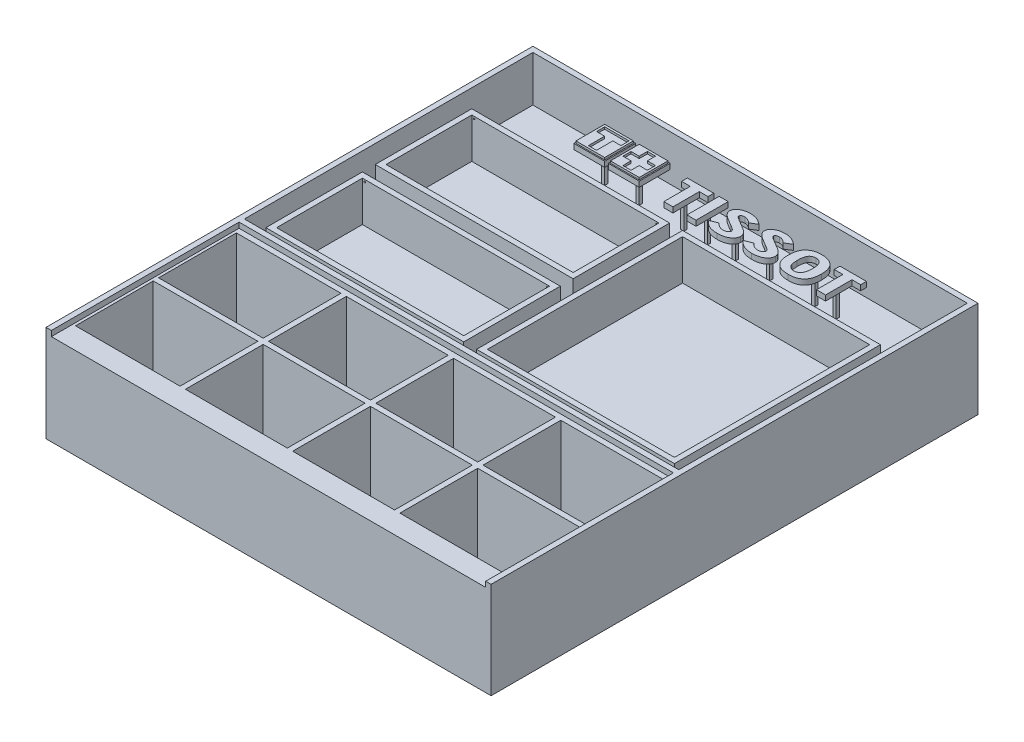
from build123d import *

# Parameters (mm, degrees)
SKETCH1_W                                     = 2025
SKETCH1_H                                     = 2145
BOSS_EXTRUDE1_DEPTH                           = 25
BOSS_EXTRUDE2_DEPTH                           = 450
BOSS_EXTRUDE3_DEPTH                           = 425
BOSS_EXTRUDE4_START                           = 25
BOSS_EXTRUDE4_DEPTH                           = 400
SKETCH12_W                                    = 25
SKETCH12_H                                    = 750
SKETCH12_W_2                                  = 2000
SKETCH12_H_2                                  = 25
EXTRUDE_THIN2_DEPTH                           = 400
CBORE_FOR_M4_PAN_HEAD_MACHINE_SCREW1_AT_COUNT = 2
CBORE_FOR_M4_PAN_HEAD_MACHINE_SCREW1_AT_PITCH = 27
SKETCH2_W                                     = 1345
SKETCH2_H                                     = 25
SHELVES_BACKGROUND_DEPTH                      = 2050
STONE_ON_COUNTER_START                        = -25
STONE_ON_COUNTER_DEPTH                        = 2025
SKETCH3_W                                     = 922.5
SKETCH3_H                                     = 450
SKETCH3_W_2                                   = 872.5
SKETCH3_H_2                                   = 400
SKETCH3_H_3                                   = 960
SKETCH3_H_4                                   = 910
PROTRUDED_SHELVES_DEPTH                       = 187.5
BOTTOM_LEFT_HINGE_HOLE_START                  = -10
SKETCH9_R                                     = 3.5
BOTTOM_LEFT_HINGE_HOLE_DEPTH                  = 420
TOP_LEFT_HINGE_HOLE_START                     = -10
SKETCH11_R                                    = 3.5
TOP_LEFT_HINGE_HOLE_DEPTH                     = 420
SKETCH5_W                                     = 15
SKETCH5_H                                     = 15
LOGO_DEPTH                                    = 137.5
LOGO_EXTRUSION_START                          = 137.5
SKETCH5_3_W                                   = 144
SKETCH5_3_H                                   = 144
LOGO_EXTRUSION_DEPTH                          = 25
LOGO_EXTRUSION_2_DEPTH                        = 25
LOGO_SUPPORT_START                            = 162.5
SKETCH5_5_W                                   = 134
SKETCH5_5_H                                   = 134
LOGO_SUPPORT_DEPTH                            = 10
NAME_DEPTH                                    = 25
SKETCH7_W                                     = 42.307692308
SKETCH7_H                                     = 150
NAME_2_DEPTH                                  = 25
NAME_3_DEPTH                                  = 25
NAME_4_DEPTH                                  = 25
NAME_5_DEPTH                                  = 25
NAME_6_DEPTH                                  = 25
SKETCH8_W                                     = 15
SKETCH8_H                                     = 15
NAME_SUPPORT_DEPTH                            = 137.5
LPATTERN3_COUNT                               = 4
LPATTERN3_PITCH                               = 500
LPATTERN3_COUNT_DIR2                          = 2
LPATTERN3_PITCH_DIR2                          = 387.5


with BuildPart() as part:
    # Sketch1 → Boss-Extrude1 (new body)
    with BuildSketch(Plane(origin=(0, 0, 0), x_dir=(1, 0, 0), z_dir=(0, 1, 0))):
        with Locations((0, 37.5)):
            Rectangle(SKETCH1_W, SKETCH1_H)
    extrude(amount=BOSS_EXTRUDE1_DEPTH)

    # Sketch1<3> → Boss-Extrude2 (add)
    with BuildSketch(Plane(origin=(0, 0, 0), x_dir=(1, 0, 0), z_dir=(0, 1, 0))):
        Polygon((-1012.5, -1135), (-1012.5, -1035), (-1012.5, -285), (-1012.5, -260), (-1012.5, 1110), (1012.5, 1110), (1012.5, -260), (1012.5, -285), (1012.5, -1035), (1012.5, -1135), (1037.5, -1135), (1037.5, 1135), (-1037.5, 1135), (-1037.5, -1135), align=None)
    extrude(amount=BOSS_EXTRUDE2_DEPTH)

    # Sketch1<4> → Boss-Extrude3 (add)
    with BuildSketch(Plane(origin=(0, 0, 0), x_dir=(1, 0, 0), z_dir=(0, 1, 0))):
        Polygon((-1000, -1035), (-1012.5, -1035), (-1012.5, -1135), (1012.5, -1135), (1012.5, -1035), (1000, -1035), align=None)
    extrude(amount=BOSS_EXTRUDE3_DEPTH)

    # Sketch1<5> → Boss-Extrude4 (add)
    with BuildSketch(Plane(origin=(0, 0, 0), x_dir=(1, 0, 0), z_dir=(0, 1, 0)).offset(BOSS_EXTRUDE4_START)):
        Polygon((-1012.5, -1035), (-1000, -1035), (-1000, -285), (1000, -285), (1000, -1035), (1012.5, -1035), (1012.5, -260), (-1012.5, -260), align=None)
    extrude(amount=BOSS_EXTRUDE4_DEPTH)

    # Sketch12 → Extrude-Thin2 (add)
    with BuildSketch(Plane(origin=(0, 25, 0), x_dir=(1, 0, 0), z_dir=(0, 1, 0))):
        with Locations((0, -660)):
            Rectangle(SKETCH12_W, SKETCH12_H)
        with Locations((-500, -660)):
            Rectangle(SKETCH12_W, SKETCH12_H)
        with Locations((500, -660)):
            Rectangle(SKETCH12_W, SKETCH12_H)
        with Locations((0, -660)):
            Rectangle(SKETCH12_W_2, SKETCH12_H_2)
    extrude(amount=EXTRUDE_THIN2_DEPTH)

    # Sketch17 → CBORE for M4 Pan Head Machine Screw1 (revolve, cut)
    with BuildSketch(Plane(origin=(-512.5, 395, 840.25), x_dir=(0, 0, 1), z_dir=(0, 1, 0))):
        Polygon((0, 0), (0, 21.351936393), (2.25, 20), (2.25, 3.1), (4.5, 3.1), (4.5, 0), align=None)
    cbore_for_m4_pan_head_machine_screw1 = revolve(axis=Axis((-518.85, 395, 840.25), (1, 0, 0)), mode=Mode.SUBTRACT)

    # CBORE for M4 Pan Head Machine Screw1 at: CBORE for M4 Pan Head Machine Screw1 ×2
    with Locations(*[(0, 0, i * CBORE_FOR_M4_PAN_HEAD_MACHINE_SCREW1_AT_PITCH) for i in range(1, CBORE_FOR_M4_PAN_HEAD_MACHINE_SCREW1_AT_COUNT)]):
        add(cbore_for_m4_pan_head_machine_screw1, mode=Mode.SUBTRACT)

    # Sketch2 → shelves_background (add)
    with BuildSketch(Plane.ZY.offset(1037.5)):
        with Locations((-437.5, 225)):
            Rectangle(SKETCH2_W, SKETCH2_H)
    extrude(amount=-SHELVES_BACKGROUND_DEPTH)

    # Sketch2<3> → stone_on_counter (add)
    with BuildSketch(Plane.ZY.offset(1037.5).offset(STONE_ON_COUNTER_START)):
        Polygon((235, 450), (235, 237.5), (235, 212.5), (235, 25), (260, 25), (260, 425), (260, 450), align=None)
    extrude(amount=-STONE_ON_COUNTER_DEPTH)

    # Sketch3 → protruded_shelves (add)
    # profile 1 of 3: a face of its own
    with BuildSketch(Plane(origin=(0, 237.5, 0), x_dir=(1, 0, 0), z_dir=(0, 1, 0))):
        with Locations((-491.25, 540)):
            Rectangle(SKETCH3_W, SKETCH3_H)
        with Locations((-491.25, 540)):
            Rectangle(SKETCH3_W_2, SKETCH3_H_2, mode=Mode.SUBTRACT)
    # profile 2 of 3: a face of its own
    with BuildSketch(Plane(origin=(0, 237.5, 0), x_dir=(1, 0, 0), z_dir=(0, 1, 0))):
        with Locations((-491.25, 30)):
            Rectangle(SKETCH3_W, SKETCH3_H)
        with Locations((-491.25, 30)):
            Rectangle(SKETCH3_W_2, SKETCH3_H_2, mode=Mode.SUBTRACT)
    # profile 3 of 3: a face of its own
    with BuildSketch(Plane(origin=(0, 237.5, 0), x_dir=(1, 0, 0), z_dir=(0, 1, 0))):
        with Locations((491.25, 285)):
            Rectangle(SKETCH3_W, SKETCH3_H_3)
        with Locations((491.25, 285)):
            Rectangle(SKETCH3_W_2, SKETCH3_H_4, mode=Mode.SUBTRACT)
    extrude(amount=PROTRUDED_SHELVES_DEPTH)

    # Sketch9 → bottom_left_hinge_hole (cut)
    with BuildSketch(Plane(origin=(0, 0, 170), x_dir=(-1, 0, 0), z_dir=(0, 0, -1)).offset(BOTTOM_LEFT_HINGE_HOLE_START)):
        with Locations(Location((916.5, 415, 0), (0, 0, 180))):
            Circle(SKETCH9_R)
        with Locations(Location((66, 415, 0), (0, 0, 180))):
            Circle(SKETCH9_R)
    extrude(amount=BOTTOM_LEFT_HINGE_HOLE_DEPTH, mode=Mode.SUBTRACT)

    # Sketch11 → top_left_hinge_hole (cut)
    with BuildSketch(Plane(origin=(0, 0, -340), x_dir=(-1, 0, 0), z_dir=(0, 0, -1)).offset(TOP_LEFT_HINGE_HOLE_START)):
        with Locations(Location((916.5, 415, 0), (0, 0, 180))):
            Circle(SKETCH11_R)
        with Locations(Location((66, 415, 0), (0, 0, 180))):
            Circle(SKETCH11_R)
    extrude(amount=TOP_LEFT_HINGE_HOLE_DEPTH, mode=Mode.SUBTRACT)

    # Sketch5 → logo (add)
    with BuildSketch(Plane(origin=(0, 237.5, 0), x_dir=(1, 0, 0), z_dir=(0, 1, 0))):
        with Locations((-528, 960)):
            Rectangle(SKETCH5_W, SKETCH5_H)
        with Locations((-367, 960)):
            Rectangle(SKETCH5_W, SKETCH5_H)
    extrude(amount=LOGO_DEPTH)



with BuildPart() as body_2:
    # Sketch5<3> → logo_extrusion (new body)
    with BuildSketch(Plane(origin=(0, 237.5, 0), x_dir=(1, 0, 0), z_dir=(0, 1, 0)).offset(LOGO_EXTRUSION_START)):
        with Locations((-528, 960)):
            Rectangle(SKETCH5_3_W, SKETCH5_3_H)
    extrude(amount=LOGO_EXTRUSION_DEPTH)


with BuildPart() as body_3:
    # Sketch5<3> → logo_extrusion 2 (new body)
    with BuildSketch(Plane(origin=(0, 237.5, 0), x_dir=(1, 0, 0), z_dir=(0, 1, 0)).offset(LOGO_EXTRUSION_START)):
        with Locations((-367, 960)):
            Rectangle(SKETCH5_3_W, SKETCH5_3_H)
    extrude(amount=LOGO_EXTRUSION_2_DEPTH)


with BuildPart() as part_1:
    add(part.part)

    add(body_2.part)  # logo_support merges body 2

    add(body_3.part)  # logo_support merges body 3
    # Sketch5<5> → logo_support (add)
    # profile 1 of 2: a face of its own
    with BuildSketch(Plane(origin=(0, 237.5, 0), x_dir=(1, 0, 0), z_dir=(0, 1, 0)).offset(LOGO_SUPPORT_START)):
        with Locations((-528, 960)):
            Rectangle(SKETCH5_5_W, SKETCH5_5_H)
        Polygon((-547, 979), (-585, 979), (-585, 1017), (-471, 1017), (-471, 979), (-509, 979), (-509, 903), (-547, 903), align=None, mode=Mode.SUBTRACT)
    # profile 2 of 2: a face of its own
    with BuildSketch(Plane(origin=(0, 237.5, 0), x_dir=(1, 0, 0), z_dir=(0, 1, 0)).offset(LOGO_SUPPORT_START)):
        with Locations((-367, 960)):
            Rectangle(SKETCH5_5_W, SKETCH5_5_H)
        Polygon((-348, 903), (-386, 903), (-386, 941), (-424, 941), (-424, 979), (-386, 979), (-386, 1017), (-348, 1017), (-348, 979), (-310, 979), (-310, 941), (-348, 941), align=None, mode=Mode.SUBTRACT)
    extrude(amount=LOGO_SUPPORT_DEPTH)



with BuildPart() as body_2_2:
    # Sketch7 → name (new body)
    with BuildSketch(Plane(origin=(0, 375, 0), x_dir=(-1, 0, 0), z_dir=(0, -1, 0))):
        Polygon((220.384615385, 1038), (97.307692308, 1038), (97.307692308, 1011.076923077), (137.692307692, 1011.076923077), (137.692307692, 888), (180, 888), (180, 1011.076923077), (220.384615385, 1011.076923077), align=None)
    extrude(amount=NAME_DEPTH)


with BuildPart() as body_3_2:
    # Sketch7 → name 2 (new body)
    with BuildSketch(Plane(origin=(0, 375, 0), x_dir=(-1, 0, 0), z_dir=(0, -1, 0))):
        with Locations((51.153846154, 963)):
            Rectangle(SKETCH7_W, SKETCH7_H)
    extrude(amount=NAME_2_DEPTH)


with BuildPart() as body_4:
    # Sketch7 → name 3 (new body)
    with BuildSketch(Plane(origin=(0, 375, 0), x_dir=(-1, 0, 0), z_dir=(0, -1, 0))):
        with BuildLine():
            Line((-133.461538462, 1017.957932692), (-103.293269231, 999.538461538))
            add(Edge.make_bspline(
                [(-103.293269231, 999.538461538), (-101.978335007, 1000.760061751), (-99.424072217, 1003.133023005), (-95.408678914, 1006.273865062), (-91.379562967, 1008.929371206), (-87.334461858, 1011.118986276), (-83.258708897, 1012.819912508), (-79.158283255, 1014.022906981), (-75.036270385, 1014.784232357), (-72.276818472, 1014.876892776), (-70.901442308, 1014.923076923)],
                knots=[0, 0, 0, 0, 1.171147426, 2.2749566, 3.323050126, 4.317573864, 5.273103732, 6.19990856, 7.102791809, 8, 8, 8, 8], degree=3))
            add(Edge.make_bspline(
                [(-70.901442308, 1014.923076923), (-69.627142137, 1014.893902899), (-67.18460837, 1014.837983154), (-63.697076713, 1014.265651715), (-60.57058469, 1013.307727204), (-57.852858452, 1012.010234562), (-55.648615622, 1010.472023865), (-53.962458732, 1008.839406217), (-52.909455074, 1007.015486427), (-52.762744888, 1005.719549522), (-52.692307692, 1005.097355769)],
                knots=[0, 0, 0, 0, 1.360082956, 2.606959194, 3.76074026, 4.842022925, 5.809530102, 6.618933995, 7.336934817, 8, 8, 8, 8], degree=3))
            add(Edge.make_bspline(
                [(-52.692307692, 1005.097355769), (-52.742544589, 1004.470345068), (-52.845170472, 1003.18946327), (-53.586108064, 1001.31626791), (-54.78694529, 999.517922907), (-55.855889592, 998.468155771), (-56.418269231, 997.915865385)],
                knots=[0, 0, 0, 0, 0.902897558, 1.844474178, 2.86596165, 4, 4, 4, 4], degree=3))
            add(Edge.make_bspline(
                [(-56.418269231, 997.915865385), (-56.943715447, 997.47811864), (-58.169930505, 996.456564706), (-60.434430616, 994.895356256), (-63.271777317, 992.921780945), (-66.804599465, 990.697529442), (-70.938509883, 988.10282689), (-75.739696796, 985.236332039), (-81.133551191, 981.969426187), (-84.979923225, 979.739971512), (-87.007211538, 978.564903846)],
                knots=[0, 0, 0, 0, 0.452903437, 1.056924567, 1.820784647, 2.743020471, 3.822058125, 5.054585401, 6.447574873, 8, 8, 8, 8], degree=3))
            add(Edge.make_bspline(
                [(-87.007211538, 978.564903846), (-88.900577986, 977.473747287), (-92.48927624, 975.405562523), (-97.58198804, 972.458591894), (-102.075361931, 969.817799609), (-105.997742433, 967.504145195), (-109.318637311, 965.493482938), (-112.066248461, 963.82146044), (-114.202221106, 962.436421817), (-115.423669297, 961.609250298), (-115.943509615, 961.257211538)],
                knots=[0, 0, 0, 0, 1.555194938, 2.947725923, 4.187355268, 5.264355205, 6.188534194, 6.950171546, 7.553199914, 8, 8, 8, 8], degree=3))
            add(Edge.make_bspline(
                [(-115.943509615, 961.257211538), (-116.970188419, 960.532974035), (-118.966043624, 959.125062246), (-121.791379179, 956.958688433), (-124.391260947, 954.818622134), (-126.751343535, 952.706900673), (-128.874927603, 950.600421903), (-130.812459549, 948.560131432), (-132.445808963, 946.46813054), (-134.383634777, 943.815530644), (-136.292980634, 940.364563701), (-138.031539861, 936.047918761), (-139.039399373, 931.50575337), (-139.166731639, 928.409382016), (-139.230769231, 926.852163462)],
                knots=[0, 0, 0, 0, 1.042789868, 2.027174983, 2.954322519, 3.837370047, 4.654520587, 5.436930517, 6.170511782, 6.855718857, 8.162256492, 9.431278027, 10.708145419, 12, 12, 12, 12], degree=3))
            add(Edge.make_bspline(
                [(-139.230769231, 926.852163462), (-139.172601916, 925.335505003), (-139.057973764, 922.346682864), (-138.157577384, 917.963837635), (-136.681641322, 913.79749529), (-134.604104519, 909.833627992), (-131.921329008, 906.098100001), (-128.696295932, 902.524627489), (-124.823607169, 899.230521995), (-120.462289852, 896.11310612), (-115.609729018, 893.324757764), (-110.386000889, 890.834252967), (-104.788018582, 888.77748491), (-98.838103899, 887.097251491), (-92.542060925, 885.781438374), (-85.899343539, 884.826494652), (-78.894706511, 884.243784247), (-74.10772685, 884.184335459), (-71.652644231, 884.153846154)],
                knots=[0, 0, 0, 0, 0.821708066, 1.619309373, 2.414467225, 3.211088349, 4.036716022, 4.901636613, 5.81393745, 6.787265425, 7.804263472, 8.843812771, 9.921025111, 11.03309076, 12.192812202, 13.405330324, 14.66928024, 16, 16, 16, 16], degree=3))
            add(Edge.make_bspline(
                [(-71.652644231, 884.153846154), (-69.718957939, 884.175974649), (-65.91824566, 884.219468801), (-60.313545979, 884.59081592), (-54.907745543, 885.181768078), (-49.683556961, 886.029037502), (-44.645707281, 887.099615366), (-39.791088133, 888.426969649), (-35.132327514, 889.9825749), (-30.655057245, 891.795974569), (-26.354446777, 893.865085607), (-22.222835061, 896.221923291), (-18.249896261, 898.843340877), (-14.414503411, 901.730989786), (-10.765580703, 904.929815615), (-7.22487719, 908.352354055), (-3.886856235, 912.090864064), (-1.815925752, 914.750640774), (-0.769230769, 916.094951923)],
                knots=[0, 0, 0, 0, 1.146972808, 2.254405821, 3.330473237, 4.371744011, 5.392591196, 6.384267033, 7.355657673, 8.304527657, 9.247912691, 10.184594247, 11.12391032, 12.069817902, 13.030078581, 14.000669363, 14.989493194, 16, 16, 16, 16], degree=3))
            Line((-0.769230769, 916.094951923), (-35.594951923, 930.307692308))
            add(Edge.make_bspline(
                [(-35.594951923, 930.307692308), (-36.899216915, 928.779403179), (-39.436942959, 925.805790343), (-43.611308885, 921.886771182), (-47.919122366, 918.549178084), (-52.390349236, 915.818856627), (-57.010399021, 913.698860568), (-61.780101513, 912.179176443), (-66.708309504, 911.246673289), (-70.056077826, 911.133794799), (-71.742788462, 911.076923077)],
                knots=[0, 0, 0, 0, 1.136826031, 2.21193779, 3.235016942, 4.217284923, 5.171404207, 6.105770855, 7.045627971, 8, 8, 8, 8], degree=3))
            add(Edge.make_bspline(
                [(-71.742788462, 911.076923077), (-73.449196368, 911.124584979), (-76.752420246, 911.216847756), (-81.476226667, 912.042092241), (-85.804578104, 913.344637934), (-89.020744157, 914.95971522), (-91.338206281, 916.396923652), (-92.816104047, 917.538558349), (-94.066191303, 918.733067577), (-95.130562849, 919.937423235), (-95.91531781, 921.228887269), (-96.511994827, 922.53323533), (-96.844759579, 923.901147716), (-96.896999635, 924.827330045), (-96.923076923, 925.289663462)],
                knots=[0, 0, 0, 0, 1.947922335, 3.77074177, 5.460842034, 7.093251747, 7.864655766, 8.57417329, 9.221652186, 9.83847831, 10.403688349, 10.941600173, 11.471666007, 12, 12, 12, 12], degree=3))
            add(Edge.make_bspline(
                [(-96.923076923, 925.289663462), (-96.86053399, 926.151796029), (-96.730912897, 927.938577681), (-95.559171106, 930.536060352), (-93.81112172, 933.129857611), (-91.778852642, 935.218547183), (-89.702867764, 936.956835347), (-87.705901965, 938.502032275), (-85.279977501, 940.191303363), (-82.44037485, 942.058293551), (-79.19210446, 944.097977783), (-75.536869439, 946.313513711), (-71.460490498, 948.698755122), (-68.590254984, 950.314101313), (-67.085336538, 951.161057692)],
                knots=[0, 0, 0, 0, 0.755635226, 1.56606444, 2.468347946, 3.503504105, 4.116475286, 4.851831446, 5.725046546, 6.717811324, 7.842987722, 9.100973178, 10.47998573, 12, 12, 12, 12], degree=3))
            add(Edge.make_bspline(
                [(-67.085336538, 951.161057692), (-64.225585395, 952.774599065), (-58.753640537, 955.862003868), (-50.985971796, 960.433460458), (-44.008268519, 964.723278433), (-37.821886528, 968.734748559), (-32.430774017, 972.462255344), (-27.809882439, 975.874873893), (-23.98663424, 979.010906667), (-20.875222032, 981.918861795), (-18.407878826, 984.745874254), (-16.227851087, 987.431140908), (-14.475278597, 990.186619005), (-12.964690149, 992.897483144), (-11.82393181, 995.632047897), (-11.012395713, 998.362192778), (-10.457116434, 1001.078457622), (-10.408653267, 1002.901201689), (-10.384615385, 1003.805288462)],
                knots=[0, 0, 0, 0, 1.958244853, 3.746972136, 5.374921427, 6.842884382, 8.143630164, 9.283370471, 10.267704041, 11.09162912, 11.81936134, 12.504123255, 13.151960596, 13.764086445, 14.353160906, 14.914442949, 15.461560299, 16, 16, 16, 16], degree=3))
            add(Edge.make_bspline(
                [(-10.384615385, 1003.805288462), (-10.434979021, 1005.091827528), (-10.534769221, 1007.640968143), (-11.3874721, 1011.386395732), (-12.744975074, 1014.989725802), (-14.66447605, 1018.446780534), (-17.140489351, 1021.730506674), (-20.102556507, 1024.915161004), (-23.650965423, 1027.909702496), (-27.681650458, 1030.730428622), (-32.100932616, 1033.32633787), (-36.821035506, 1035.614341103), (-41.802356872, 1037.530095134), (-47.018822575, 1039.13665341), (-52.495719675, 1040.358542698), (-58.228159231, 1041.227505987), (-64.21141164, 1041.738647148), (-68.286274049, 1041.809888525), (-70.360576923, 1041.846153846)],
                knots=[0, 0, 0, 0, 0.789719771, 1.56474591, 2.347746179, 3.14936716, 3.9851552, 4.869112387, 5.816364336, 6.832321499, 7.888906194, 8.962419512, 10.051625332, 11.165197109, 12.313385, 13.496280738, 14.725485295, 16, 16, 16, 16], degree=3))
            add(Edge.make_bspline(
                [(-70.360576923, 1041.846153846), (-73.05781026, 1041.781950666), (-78.399400716, 1041.654802936), (-86.29912802, 1040.660397262), (-94.002220611, 1039.075641151), (-100.276384685, 1037.188450911), (-105.25743659, 1035.306336983), (-109.070809738, 1033.624466102), (-112.945585368, 1031.649655095), (-116.932167489, 1029.464153304), (-120.964802091, 1026.95957393), (-125.092631633, 1024.227031077), (-129.27641431, 1021.211926405), (-132.045996955, 1019.058536401), (-133.461538462, 1017.957932692)],
                knots=[0, 0, 0, 0, 1.408596709, 2.789579468, 4.152263913, 5.512857549, 6.20667109, 6.932870834, 7.68864351, 8.477850492, 9.306993667, 10.167502276, 11.063405241, 12, 12, 12, 12], degree=3))
        make_face()
    extrude(amount=NAME_3_DEPTH)


with BuildPart() as body_5:
    # Sketch7 → name 4 (new body)
    with BuildSketch(Plane(origin=(0, 375, 0), x_dir=(-1, 0, 0), z_dir=(0, -1, 0))):
        with BuildLine():
            Line((-295, 1017.957932692), (-264.831730769, 999.538461538))
            add(Edge.make_bspline(
                [(-264.831730769, 999.538461538), (-263.516796545, 1000.760061751), (-260.962533755, 1003.133023005), (-256.947140452, 1006.273865062), (-252.918024506, 1008.929371206), (-248.872923396, 1011.118986276), (-244.797170435, 1012.819912508), (-240.696744793, 1014.022906981), (-236.574731924, 1014.784232357), (-233.81528001, 1014.876892776), (-232.439903846, 1014.923076923)],
                knots=[0, 0, 0, 0, 1.171147426, 2.2749566, 3.323050126, 4.317573864, 5.273103732, 6.19990856, 7.102791809, 8, 8, 8, 8], degree=3))
            add(Edge.make_bspline(
                [(-232.439903846, 1014.923076923), (-231.165603676, 1014.893902899), (-228.723069908, 1014.837983154), (-225.235538251, 1014.265651715), (-222.109046229, 1013.307727204), (-219.391319991, 1012.010234562), (-217.187077161, 1010.472023865), (-215.50092027, 1008.839406217), (-214.447916613, 1007.015486427), (-214.301206426, 1005.719549522), (-214.230769231, 1005.097355769)],
                knots=[0, 0, 0, 0, 1.360082956, 2.606959194, 3.76074026, 4.842022925, 5.809530102, 6.618933995, 7.336934817, 8, 8, 8, 8], degree=3))
            add(Edge.make_bspline(
                [(-214.230769231, 1005.097355769), (-214.281006128, 1004.470345068), (-214.38363201, 1003.18946327), (-215.124569602, 1001.31626791), (-216.325406829, 999.517922907), (-217.394351131, 998.468155771), (-217.956730769, 997.915865385)],
                knots=[0, 0, 0, 0, 0.902897558, 1.844474178, 2.86596165, 4, 4, 4, 4], degree=3))
            add(Edge.make_bspline(
                [(-217.956730769, 997.915865385), (-218.482176986, 997.47811864), (-219.708392043, 996.456564706), (-221.972892154, 994.895356256), (-224.810238856, 992.921780945), (-228.343061004, 990.697529442), (-232.476971422, 988.10282689), (-237.278158334, 985.236332039), (-242.672012729, 981.969426187), (-246.518384764, 979.739971512), (-248.545673077, 978.564903846)],
                knots=[0, 0, 0, 0, 0.452903437, 1.056924567, 1.820784647, 2.743020471, 3.822058125, 5.054585401, 6.447574873, 8, 8, 8, 8], degree=3))
            add(Edge.make_bspline(
                [(-248.545673077, 978.564903846), (-250.439039524, 977.473747287), (-254.027737778, 975.405562523), (-259.120449578, 972.458591894), (-263.613823469, 969.817799609), (-267.536203971, 967.504145195), (-270.857098849, 965.493482938), (-273.604709999, 963.82146044), (-275.740682645, 962.436421817), (-276.962130836, 961.609250298), (-277.481971154, 961.257211538)],
                knots=[0, 0, 0, 0, 1.555194938, 2.947725923, 4.187355268, 5.264355205, 6.188534194, 6.950171546, 7.553199914, 8, 8, 8, 8], degree=3))
            add(Edge.make_bspline(
                [(-277.481971154, 961.257211538), (-278.508649957, 960.532974035), (-280.504505162, 959.125062246), (-283.329840717, 956.958688433), (-285.929722486, 954.818622134), (-288.289805074, 952.706900673), (-290.413389142, 950.600421903), (-292.350921088, 948.560131432), (-293.984270502, 946.46813054), (-295.922096316, 943.815530644), (-297.831442173, 940.364563701), (-299.5700014, 936.047918761), (-300.577860912, 931.50575337), (-300.705193177, 928.409382016), (-300.769230769, 926.852163462)],
                knots=[0, 0, 0, 0, 1.042789868, 2.027174983, 2.954322519, 3.837370047, 4.654520587, 5.436930517, 6.170511782, 6.855718857, 8.162256492, 9.431278027, 10.708145419, 12, 12, 12, 12], degree=3))
            add(Edge.make_bspline(
                [(-300.769230769, 926.852163462), (-300.711063455, 925.335505003), (-300.596435303, 922.346682864), (-299.696038923, 917.963837635), (-298.22010286, 913.79749529), (-296.142566057, 909.833627992), (-293.459790547, 906.098100001), (-290.23475747, 902.524627489), (-286.362068708, 899.230521995), (-282.00075139, 896.11310612), (-277.148190556, 893.324757764), (-271.924462427, 890.834252967), (-266.326480121, 888.77748491), (-260.376565437, 887.097251491), (-254.080522463, 885.781438374), (-247.437805077, 884.826494652), (-240.433168049, 884.243784247), (-235.646188389, 884.184335459), (-233.191105769, 884.153846154)],
                knots=[0, 0, 0, 0, 0.821708066, 1.619309373, 2.414467225, 3.211088349, 4.036716022, 4.901636613, 5.81393745, 6.787265425, 7.804263472, 8.843812771, 9.921025111, 11.03309076, 12.192812202, 13.405330324, 14.66928024, 16, 16, 16, 16], degree=3))
            add(Edge.make_bspline(
                [(-233.191105769, 884.153846154), (-231.257419477, 884.175974649), (-227.456707199, 884.219468801), (-221.852007518, 884.59081592), (-216.446207081, 885.181768078), (-211.222018499, 886.029037502), (-206.184168819, 887.099615366), (-201.329549672, 888.426969649), (-196.670789053, 889.9825749), (-192.193518784, 891.795974569), (-187.892908315, 893.865085607), (-183.7612966, 896.221923291), (-179.7883578, 898.843340877), (-175.95296495, 901.730989786), (-172.304042242, 904.929815615), (-168.763338729, 908.352354055), (-165.425317774, 912.090864064), (-163.354387291, 914.750640774), (-162.307692308, 916.094951923)],
                knots=[0, 0, 0, 0, 1.146972808, 2.254405821, 3.330473237, 4.371744011, 5.392591196, 6.384267033, 7.355657673, 8.304527657, 9.247912691, 10.184594247, 11.12391032, 12.069817902, 13.030078581, 14.000669363, 14.989493194, 16, 16, 16, 16], degree=3))
            Line((-162.307692308, 916.094951923), (-197.133413462, 930.307692308))
            add(Edge.make_bspline(
                [(-197.133413462, 930.307692308), (-198.437678454, 928.779403179), (-200.975404497, 925.805790343), (-205.149770423, 921.886771182), (-209.457583904, 918.549178084), (-213.928810775, 915.818856627), (-218.54886056, 913.698860568), (-223.318563052, 912.179176443), (-228.246771042, 911.246673289), (-231.594539364, 911.133794799), (-233.28125, 911.076923077)],
                knots=[0, 0, 0, 0, 1.136826031, 2.21193779, 3.235016942, 4.217284923, 5.171404207, 6.105770855, 7.045627971, 8, 8, 8, 8], degree=3))
            add(Edge.make_bspline(
                [(-233.28125, 911.076923077), (-234.987657906, 911.124584979), (-238.290881784, 911.216847756), (-243.014688205, 912.042092241), (-247.343039642, 913.344637934), (-250.559205695, 914.95971522), (-252.87666782, 916.396923652), (-254.354565585, 917.538558349), (-255.604652842, 918.733067577), (-256.669024388, 919.937423235), (-257.453779349, 921.228887269), (-258.050456366, 922.53323533), (-258.383221118, 923.901147716), (-258.435461173, 924.827330045), (-258.461538462, 925.289663462)],
                knots=[0, 0, 0, 0, 1.947922335, 3.77074177, 5.460842034, 7.093251747, 7.864655766, 8.57417329, 9.221652186, 9.83847831, 10.403688349, 10.941600173, 11.471666007, 12, 12, 12, 12], degree=3))
            add(Edge.make_bspline(
                [(-258.461538462, 925.289663462), (-258.398995528, 926.151796029), (-258.269374435, 927.938577681), (-257.097632645, 930.536060352), (-255.349583258, 933.129857611), (-253.31731418, 935.218547183), (-251.241329303, 936.956835347), (-249.244363503, 938.502032275), (-246.818439039, 940.191303363), (-243.978836389, 942.058293551), (-240.730565999, 944.097977783), (-237.075330977, 946.313513711), (-232.998952036, 948.698755122), (-230.128716523, 950.314101313), (-228.623798077, 951.161057692)],
                knots=[0, 0, 0, 0, 0.755635226, 1.56606444, 2.468347946, 3.503504105, 4.116475286, 4.851831446, 5.725046546, 6.717811324, 7.842987722, 9.100973178, 10.47998573, 12, 12, 12, 12], degree=3))
            add(Edge.make_bspline(
                [(-228.623798077, 951.161057692), (-225.764046933, 952.774599065), (-220.292102076, 955.862003868), (-212.524433335, 960.433460458), (-205.546730058, 964.723278433), (-199.360348066, 968.734748559), (-193.969235556, 972.462255344), (-189.348343978, 975.874873893), (-185.525095779, 979.010906667), (-182.41368357, 981.918861795), (-179.946340365, 984.745874254), (-177.766312625, 987.431140908), (-176.013740136, 990.186619005), (-174.503151688, 992.897483144), (-173.362393348, 995.632047897), (-172.550857251, 998.362192778), (-171.995577973, 1001.078457622), (-171.947114806, 1002.901201689), (-171.923076923, 1003.805288462)],
                knots=[0, 0, 0, 0, 1.958244853, 3.746972136, 5.374921427, 6.842884382, 8.143630164, 9.283370471, 10.267704041, 11.09162912, 11.81936134, 12.504123255, 13.151960596, 13.764086445, 14.353160906, 14.914442949, 15.461560299, 16, 16, 16, 16], degree=3))
            add(Edge.make_bspline(
                [(-171.923076923, 1003.805288462), (-171.973440559, 1005.091827528), (-172.073230759, 1007.640968143), (-172.925933639, 1011.386395732), (-174.283436613, 1014.989725802), (-176.202937588, 1018.446780534), (-178.678950889, 1021.730506674), (-181.641018046, 1024.915161004), (-185.189426961, 1027.909702496), (-189.220111997, 1030.730428622), (-193.639394154, 1033.32633787), (-198.359497044, 1035.614341103), (-203.340818411, 1037.530095134), (-208.557284113, 1039.13665341), (-214.034181213, 1040.358542698), (-219.766620769, 1041.227505987), (-225.749873179, 1041.738647148), (-229.824735587, 1041.809888525), (-231.899038462, 1041.846153846)],
                knots=[0, 0, 0, 0, 0.789719771, 1.56474591, 2.347746179, 3.14936716, 3.9851552, 4.869112387, 5.816364336, 6.832321499, 7.888906194, 8.962419512, 10.051625332, 11.165197109, 12.313385, 13.496280738, 14.725485295, 16, 16, 16, 16], degree=3))
            add(Edge.make_bspline(
                [(-231.899038462, 1041.846153846), (-234.596271798, 1041.781950666), (-239.937862255, 1041.654802936), (-247.837589558, 1040.660397262), (-255.54068215, 1039.075641151), (-261.814846224, 1037.188450911), (-266.795898128, 1035.306336983), (-270.609271276, 1033.624466102), (-274.484046907, 1031.649655095), (-278.470629028, 1029.464153304), (-282.50326363, 1026.95957393), (-286.631093171, 1024.227031077), (-290.814875849, 1021.211926405), (-293.584458494, 1019.058536401), (-295, 1017.957932692)],
                knots=[0, 0, 0, 0, 1.408596709, 2.789579468, 4.152263913, 5.512857549, 6.20667109, 6.932870834, 7.68864351, 8.477850492, 9.306993667, 10.167502276, 11.063405241, 12, 12, 12, 12], degree=3))
        make_face()
    extrude(amount=NAME_4_DEPTH)


with BuildPart() as body_6:
    # Sketch7 → name 5 (new body)
    with BuildSketch(Plane(origin=(0, 375, 0), x_dir=(-1, 0, 0), z_dir=(0, -1, 0))):
        with BuildLine():
            add(Edge.make_bspline(
                [(-402.03125, 1041.846153846), (-403.995093896, 1041.826570674), (-407.856723621, 1041.788063053), (-413.541611546, 1041.380770815), (-419.025745133, 1040.7517475), (-424.307906302, 1039.901397931), (-429.377340482, 1038.738882979), (-434.2450552, 1037.382828631), (-438.89139745, 1035.706656923), (-443.334284524, 1033.82818426), (-447.573061407, 1031.690261585), (-451.553190633, 1029.270010817), (-455.278883513, 1026.56316596), (-458.775710994, 1023.632143787), (-461.995715377, 1020.381901043), (-465.008267746, 1016.920041807), (-467.723427523, 1013.141830713), (-470.235317459, 1009.112978655), (-472.473624176, 1004.727561236), (-474.396667588, 999.950321049), (-476.010464747, 994.77271451), (-477.317134604, 989.186072397), (-478.383137741, 983.200692976), (-479.065382592, 976.79445586), (-479.538556223, 969.998282273), (-479.589318825, 965.334620252), (-479.615384615, 962.939903846)],
                knots=[0, 0, 0, 0, 1.112436274, 2.187453387, 3.227067041, 4.239248232, 5.216649243, 6.172261611, 7.100196429, 8.012946853, 8.903700918, 9.787359542, 10.648877062, 11.510581442, 12.369253685, 13.238325419, 14.107767586, 15.002201277, 15.92596261, 16.893296613, 17.916284118, 18.995352245, 20.141912979, 21.35823278, 22.643494474, 24, 24, 24, 24], degree=3))
            add(Edge.make_bspline(
                [(-479.615384615, 962.939903846), (-479.588214963, 960.515295989), (-479.535397593, 955.80189705), (-479.079723191, 948.942362913), (-478.337227905, 942.492340331), (-477.301068805, 936.458598483), (-475.949493274, 930.835520156), (-474.298631135, 925.621871338), (-472.370320963, 920.802812665), (-470.078013486, 916.415467722), (-467.579997538, 912.372346902), (-464.851838942, 908.629598285), (-461.95256234, 905.135126284), (-458.80809335, 901.93896733), (-455.463381022, 899.016260258), (-451.91704576, 896.357774409), (-448.130441011, 894.018257857), (-444.162897609, 891.903047218), (-439.942790694, 890.059528174), (-435.475540941, 888.469230292), (-430.728118847, 887.16541924), (-425.740416011, 886.032796678), (-420.475552957, 885.225290415), (-414.955758365, 884.572232826), (-409.167213702, 884.223299813), (-405.216752624, 884.177295471), (-403.203125, 884.153846154)],
                knots=[0, 0, 0, 0, 1.383254435, 2.689024525, 3.920288788, 5.086229236, 6.179830814, 7.217235242, 8.20416048, 9.137076681, 10.037845884, 10.913446542, 11.777577634, 12.626206931, 13.468617664, 14.309825757, 15.151829337, 16.005676296, 16.873145597, 17.776900934, 18.708678738, 19.680599171, 20.693393086, 21.746047846, 22.851116305, 24, 24, 24, 24], degree=3))
            add(Edge.make_bspline(
                [(-403.203125, 884.153846154), (-401.189484211, 884.17733919), (-397.229000379, 884.223545937), (-391.410795618, 884.574375244), (-385.840366548, 885.223862427), (-380.507579115, 886.039544698), (-375.43264928, 887.154934944), (-370.597757205, 888.512547831), (-366.006771671, 890.094189727), (-361.651235373, 891.925588243), (-357.55664927, 894.048060712), (-353.663350603, 896.380529068), (-350.024324371, 899.00501337), (-346.617993514, 901.876108246), (-343.413958409, 904.970278782), (-340.463910172, 908.358684256), (-337.734975935, 911.994835286), (-335.199349817, 915.896930107), (-332.980442593, 920.166277947), (-330.999705827, 924.815165952), (-329.415116421, 929.919794281), (-328.044032687, 935.422291262), (-327.055957646, 941.363598562), (-326.301683585, 947.709587984), (-325.849950813, 954.479851816), (-325.796655728, 959.13312847), (-325.769230769, 961.527644231)],
                knots=[0, 0, 0, 0, 1.151732354, 2.265258726, 3.331907396, 4.358527985, 5.349640336, 6.301823884, 7.229442188, 8.125366087, 9.001640915, 9.865258498, 10.719034236, 11.56477644, 12.411507624, 13.264090857, 14.131443655, 15.010224322, 15.92248397, 16.880098005, 17.896501611, 18.976117643, 20.121391741, 21.338640018, 22.630498701, 24, 24, 24, 24], degree=3))
            add(Edge.make_bspline(
                [(-325.769230769, 961.527644231), (-325.77458537, 963.220739283), (-325.785110321, 966.548670631), (-326.051377731, 971.447347686), (-326.394935374, 976.168841854), (-326.906023181, 980.719751812), (-327.57236968, 985.086790607), (-328.330830862, 989.286089709), (-329.316914471, 993.28635245), (-330.380827535, 997.133719841), (-331.606931131, 1000.797983334), (-333.002713205, 1004.273834763), (-334.523795106, 1007.581282347), (-336.217473158, 1010.70092558), (-338.006914945, 1013.675642275), (-340.017098533, 1016.424388855), (-342.088571067, 1019.062978328), (-343.633550659, 1020.654808737), (-344.399038462, 1021.443509615)],
                knots=[0, 0, 0, 0, 1.262561395, 2.481678533, 3.657929334, 4.793063925, 5.896033769, 6.95240804, 7.974304985, 8.967596034, 9.929055793, 10.854312468, 11.760063486, 12.642439361, 13.500836279, 14.346659111, 15.180822653, 16, 16, 16, 16], degree=3))
            add(Edge.make_bspline(
                [(-344.399038462, 1021.443509615), (-346.164239586, 1023.082028698), (-349.703296518, 1026.367100432), (-355.719539832, 1030.480963799), (-362.183679203, 1034.049309543), (-369.2020137, 1036.870766153), (-376.686057616, 1039.149580179), (-384.689003137, 1040.720819936), (-393.194907568, 1041.653297405), (-399.034034538, 1041.78073851), (-402.03125, 1041.846153846)],
                knots=[0, 0, 0, 0, 0.920032708, 1.844576286, 2.778885452, 3.739249875, 4.731776043, 5.76703601, 6.8538228, 8, 8, 8, 8], degree=3))
        make_face()
        with BuildLine():
            add(Edge.make_bspline(
                [(-402.992788462, 1014.923076923), (-401.306114333, 1014.866258284), (-398.009514544, 1014.755206417), (-393.220818379, 1013.859980087), (-388.717361511, 1012.41583659), (-385.212456393, 1010.708345039), (-382.587626616, 1009.034389772), (-380.75077183, 1007.547416815), (-379.026101523, 1005.868087485), (-377.468594685, 1003.933688372), (-375.962124278, 1001.856166214), (-374.600594005, 999.540012907), (-373.377219036, 997.013645853), (-372.262161127, 994.263773475), (-371.256832686, 991.246358326), (-370.395295178, 987.923649794), (-369.687000863, 984.268333069), (-369.080356838, 980.300186365), (-368.646235473, 975.996811257), (-368.32050092, 971.367332638), (-368.100272744, 966.407558605), (-368.084869782, 962.990232459), (-368.076923077, 961.227163462)],
                knots=[0, 0, 0, 0, 1.380715398, 2.69860432, 3.975061736, 5.244566387, 5.879464493, 6.521373602, 7.176925873, 7.847099661, 8.552836415, 9.277442563, 10.044288363, 10.850205762, 11.70633793, 12.647550717, 13.659576078, 14.754866935, 15.934478798, 17.201117267, 18.555998707, 20, 20, 20, 20], degree=3))
            add(Edge.make_bspline(
                [(-368.076923077, 961.227163462), (-368.10265732, 958.942590931), (-368.152036279, 954.55894495), (-368.610437577, 948.260222086), (-369.322697353, 942.510541327), (-370.425569141, 937.316554091), (-371.726582522, 932.63586185), (-373.4312987, 928.529163176), (-375.34926359, 924.920843047), (-377.694263509, 921.915727351), (-380.23553279, 919.345851775), (-382.957758449, 917.145498138), (-385.836720581, 915.252781257), (-388.910588135, 913.714575254), (-392.182974473, 912.543379116), (-395.627099837, 911.704801502), (-399.250917913, 911.181557956), (-401.72898527, 911.112263127), (-402.992788462, 911.076923077)],
                knots=[0, 0, 0, 0, 1.575252503, 3.022600163, 4.35315567, 5.566962488, 6.681808258, 7.697727682, 8.628272461, 9.490362916, 10.315811898, 11.116259234, 11.899839206, 12.687548746, 13.480690829, 14.291531521, 15.12868877, 16, 16, 16, 16], degree=3))
            add(Edge.make_bspline(
                [(-402.992788462, 911.076923077), (-404.20644347, 911.101771835), (-406.573764565, 911.15024112), (-410.027918969, 911.645272116), (-413.294191191, 912.450886357), (-416.365510789, 913.59770421), (-419.253663783, 915.04978579), (-421.940146688, 916.830261008), (-424.42411354, 918.948451284), (-425.896097061, 920.565507755), (-426.640625, 921.383413462)],
                knots=[0, 0, 0, 0, 1.091302472, 2.128663701, 3.131840602, 4.112711437, 5.071858247, 6.034090295, 7.005644642, 8, 8, 8, 8], degree=3))
            add(Edge.make_bspline(
                [(-426.640625, 921.383413462), (-427.503220787, 922.483924001), (-429.279960406, 924.750710725), (-431.4229987, 928.694997969), (-433.248587761, 933.130660306), (-434.744295466, 938.09405953), (-435.896324279, 943.573762918), (-436.733711053, 949.56657479), (-437.19702398, 956.081630673), (-437.269860885, 960.595436954), (-437.307692308, 962.939903846)],
                knots=[0, 0, 0, 0, 0.766208561, 1.578205142, 2.452976731, 3.395346171, 4.418397344, 5.522951765, 6.713423391, 8, 8, 8, 8], degree=3))
            add(Edge.make_bspline(
                [(-437.307692308, 962.939903846), (-437.280968261, 965.304431292), (-437.229505626, 969.85781402), (-436.781534286, 976.398363909), (-436.045223362, 982.370581698), (-435.012291467, 987.768812306), (-433.662811166, 992.592717725), (-432.066478224, 996.874494705), (-430.116153074, 1000.579829713), (-427.833545082, 1003.706334178), (-425.318755741, 1006.35630192), (-422.649596376, 1008.643819223), (-419.796088553, 1010.585578144), (-416.779579224, 1012.194074222), (-413.578812544, 1013.42494323), (-410.203715243, 1014.305768156), (-406.654171807, 1014.814515959), (-404.226365281, 1014.886501051), (-402.992788462, 1014.923076923)],
                knots=[0, 0, 0, 0, 1.604711339, 3.090200923, 4.446911378, 5.686814525, 6.816710896, 7.843133766, 8.782871035, 9.649035259, 10.461770641, 11.257380578, 12.030453245, 12.799840669, 13.572464857, 14.352381906, 15.162839598, 16, 16, 16, 16], degree=3))
        make_face(mode=Mode.SUBTRACT)
    extrude(amount=NAME_5_DEPTH)


with BuildPart() as body_7:
    # Sketch7 → name 6 (new body)
    with BuildSketch(Plane(origin=(0, 375, 0), x_dir=(-1, 0, 0), z_dir=(0, -1, 0))):
        Polygon((-491.153846154, 1038), (-614.230769231, 1038), (-614.230769231, 1011.076923077), (-573.846153846, 1011.076923077), (-573.846153846, 888), (-531.538461538, 888), (-531.538461538, 1011.076923077), (-491.153846154, 1011.076923077), align=None)
    extrude(amount=NAME_6_DEPTH)


with BuildPart() as part_2:
    add(part_1.part)

    add(body_2_2.part)  # name_support merges body 2 2

    add(body_3_2.part)  # name_support merges body 3 2

    add(body_4.part)  # name_support merges body 4

    add(body_5.part)  # name_support merges body 5

    add(body_6.part)  # name_support merges body 6

    add(body_7.part)  # name_support merges body 7
    # Sketch8 → name_support (add)
    with BuildSketch(Plane(origin=(0, 375, 0), x_dir=(1, 0, 0), z_dir=(0, 1, 0))):
        with Locations((-158.463387899, 960)):
            Rectangle(SKETCH8_W, SKETCH8_H)
        with Locations((-48.463387899, 960)):
            Rectangle(SKETCH8_W, SKETCH8_H)
        with Locations((81.536612101, 960)):
            Rectangle(SKETCH8_W, SKETCH8_H)
        with Locations((241.536612101, 960)):
            Rectangle(SKETCH8_W, SKETCH8_H)
        with Locations((451.536612101, 960)):
            Rectangle(SKETCH8_W, SKETCH8_H)
        with Locations((551.536612101, 960)):
            Rectangle(SKETCH8_W, SKETCH8_H)
    extrude(amount=-NAME_SUPPORT_DEPTH)

    # LPattern3: CBORE for M4 Pan Head Machine Screw1 4 × 2
    with Locations(*[(i * LPATTERN3_PITCH, 0, -j * LPATTERN3_PITCH_DIR2) for i in range(LPATTERN3_COUNT) for j in range(LPATTERN3_COUNT_DIR2) if (i, j) != (0, 0)]):
        add(cbore_for_m4_pan_head_machine_screw1, mode=Mode.SUBTRACT)

    # LPattern3 copy 1 sketch → LPattern3 copy 1 (revolve, cut)
    with BuildSketch(Plane(origin=(-512.5, 395, 479.75), x_dir=(0, 0, 1), z_dir=(0, 1, 0))):
        Polygon((0, 0), (0, 21.351936393), (2.25, 20), (2.25, 3.1), (4.5, 3.1), (4.5, 0), align=None)
    revolve(axis=Axis((-518.85, 395, 479.75), (1, 0, 0)), mode=Mode.SUBTRACT)

    # LPattern3 copy 2 sketch → LPattern3 copy 2 (revolve, cut)
    with BuildSketch(Plane(origin=(-12.5, 395, 867.25), x_dir=(0, 0, 1), z_dir=(0, 1, 0))):
        Polygon((0, 0), (0, 21.351936393), (2.25, 20), (2.25, 3.1), (4.5, 3.1), (4.5, 0), align=None)
    revolve(axis=Axis((-18.85, 395, 867.25), (1, 0, 0)), mode=Mode.SUBTRACT)

    # LPattern3 copy 3 sketch → LPattern3 copy 3 (revolve, cut)
    with BuildSketch(Plane(origin=(-12.5, 395, 479.75), x_dir=(0, 0, 1), z_dir=(0, 1, 0))):
        Polygon((0, 0), (0, 21.351936393), (2.25, 20), (2.25, 3.1), (4.5, 3.1), (4.5, 0), align=None)
    revolve(axis=Axis((-18.85, 395, 479.75), (1, 0, 0)), mode=Mode.SUBTRACT)

    # LPattern3 copy 4 sketch → LPattern3 copy 4 (revolve, cut)
    with BuildSketch(Plane(origin=(487.5, 395, 867.25), x_dir=(0, 0, 1), z_dir=(0, 1, 0))):
        Polygon((0, 0), (0, 21.351936393), (2.25, 20), (2.25, 3.1), (4.5, 3.1), (4.5, 0), align=None)
    revolve(axis=Axis((481.15, 395, 867.25), (1, 0, 0)), mode=Mode.SUBTRACT)

    # LPattern3 copy 5 sketch → LPattern3 copy 5 (revolve, cut)
    with BuildSketch(Plane(origin=(487.5, 395, 479.75), x_dir=(0, 0, 1), z_dir=(0, 1, 0))):
        Polygon((0, 0), (0, 21.351936393), (2.25, 20), (2.25, 3.1), (4.5, 3.1), (4.5, 0), align=None)
    revolve(axis=Axis((481.15, 395, 479.75), (1, 0, 0)), mode=Mode.SUBTRACT)

    # LPattern3 copy 6 sketch → LPattern3 copy 6 (revolve, cut)
    with BuildSketch(Plane(origin=(987.5, 395, 867.25), x_dir=(0, 0, 1), z_dir=(0, 1, 0))):
        Polygon((0, 0), (0, 21.351936393), (2.25, 20), (2.25, 3.1), (4.5, 3.1), (4.5, 0), align=None)
    revolve(axis=Axis((981.15, 395, 867.25), (1, 0, 0)), mode=Mode.SUBTRACT)

    # LPattern3 copy 7 sketch → LPattern3 copy 7 (revolve, cut)
    with BuildSketch(Plane(origin=(987.5, 395, 479.75), x_dir=(0, 0, 1), z_dir=(0, 1, 0))):
        Polygon((0, 0), (0, 21.351936393), (2.25, 20), (2.25, 3.1), (4.5, 3.1), (4.5, 0), align=None)
    revolve(axis=Axis((981.15, 395, 479.75), (1, 0, 0)), mode=Mode.SUBTRACT)


solid = part_2.part
